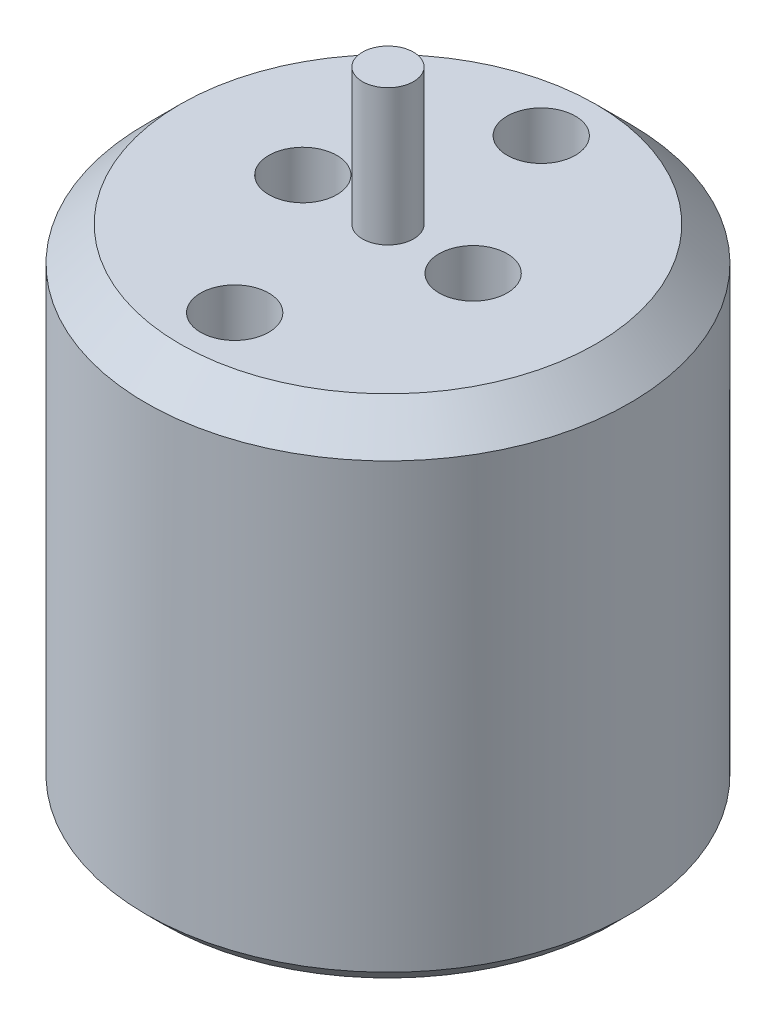
from build123d import *

# Parameters (mm, degrees)
SKETCH1_R           = 7.1
BOSS_EXTRUDE1_DEPTH = 14.5
SKETCH2_R           = 0.75
BOSS_EXTRUDE2_DEPTH = 4
SKETCH3_R           = 1
CUT_EXTRUDE1_DEPTH  = 4
CUT_EXTRUDE2_START  = -4
SKETCH4_R           = 1
CUT_EXTRUDE2_DEPTH  = 4
CHAMFER1_SIZE       = 1
CHAMFER2_SIZE       = 0.5


with BuildPart() as part:
    # Sketch1 → Boss-Extrude1 (new body)
    with BuildSketch(Plane(origin=(0, 0, 0), x_dir=(1, 0, 0), z_dir=(0, 1, 0))):
        with Locations(Location((0, 0, 0), (0, 0, 90))):
            Circle(SKETCH1_R)
    extrude(amount=BOSS_EXTRUDE1_DEPTH)

    # Sketch2 → Boss-Extrude2 (add)
    with BuildSketch(Plane(origin=(0, 14.5, 0), x_dir=(1, 0, 0), z_dir=(0, 1, 0))):
        with Locations(Location((0, 0, 0), (0, 0, 270))):
            Circle(SKETCH2_R)
    extrude(amount=BOSS_EXTRUDE2_DEPTH)

    # Sketch3 → Cut-Extrude1 (cut)
    with BuildSketch(Plane.XZ):
        with Locations(Location((-4.5, 0, 0), (0, 0, 270))):
            Circle(SKETCH3_R)
        with Locations(Location((0, 4.5, 0), (0, 0, 270))):
            Circle(SKETCH3_R)
        with Locations(Location((0, -4.5, 0), (0, 0, 270))):
            Circle(SKETCH3_R)
        with Locations(Location((4.5, 0, 0), (0, 0, 270))):
            Circle(SKETCH3_R)
    extrude(amount=-CUT_EXTRUDE1_DEPTH, mode=Mode.SUBTRACT)

    # Sketch4 → Cut-Extrude2 (cut)
    with BuildSketch(Plane(origin=(0, 14.5, 0), x_dir=(1, 0, 0), z_dir=(0, 1, 0)).offset(CUT_EXTRUDE2_START)):
        with Locations(Location((-2.5, 0, 0), (0, 0, 270))):
            Circle(SKETCH4_R)
        with Locations(Location((0, 4.5, 0), (0, 0, 90))):
            Circle(SKETCH4_R)
        with Locations(Location((0, -4.5, 0), (0, 0, 90))):
            Circle(SKETCH4_R)
        with Locations(Location((2.5, 0, 0), (0, 0, 270))):
            Circle(SKETCH4_R)
    extrude(amount=CUT_EXTRUDE2_DEPTH, mode=Mode.SUBTRACT)

    # Chamfer1
    chamfer1_edges = [part.edges().sort_by_distance(p)[0] for p in [
        (0, 14.5, 7.1),
    ]]
    chamfer(chamfer1_edges, length=CHAMFER1_SIZE)

    # Chamfer2
    chamfer2_edges = [part.edges().sort_by_distance(p)[0] for p in [
        (0, 0, 7.1),
    ]]
    chamfer(chamfer2_edges, length=CHAMFER2_SIZE)


solid = part.part
